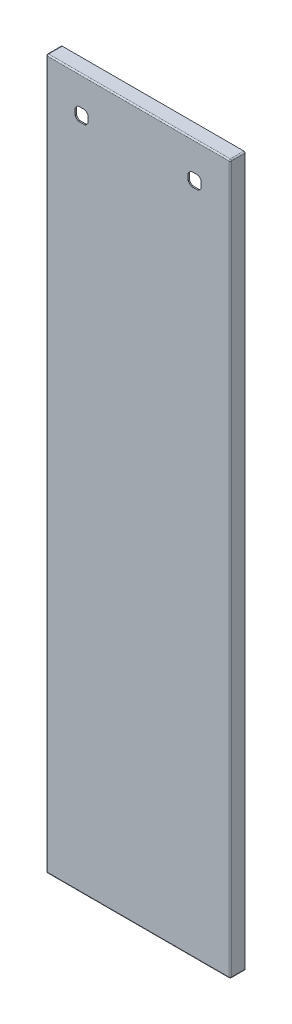
from build123d import *

# Parameters (mm, degrees)
SKIZZE1_W                       = 285
SKIZZE1_H                       = 1098
BASIS_LINEAR_AUSTRAGEN_DEPTH    = 23
WANDUNG1_T                      = -2
VERRUNDUNG1_R                   = 2
SCHNITT_LINEAR_AUSTRAGEN1_REACH = 1109.447
SCHNITT_LINEAR_AUSTRAGEN2_REACH = 1109.447


with BuildPart() as part:
    # Skizze1 → Basis-Linear austragen (new body)
    with BuildSketch(Plane.XY):
        with Locations((0, 549)):
            Rectangle(SKIZZE1_W, SKIZZE1_H)
    extrude(amount=-BASIS_LINEAR_AUSTRAGEN_DEPTH)

    # Wandung1
    wandung1_openings = [part.faces().sort_by_distance(p)[0] for p in [
        (0, 549, -23),
    ]]
    offset(amount=WANDUNG1_T, openings=wandung1_openings, kind=Kind.INTERSECTION)

    # Verrundung1
    verrundung1_edges = [part.edges().sort_by_distance(p)[0] for p in [
        (0, 1098, 0),
        (142.5, 549, 0),
        (0, 0, 0),
        (-142.5, 549, 0),
        (-142.5, 1098, -11.5),
        (142.5, 1098, -11.5),
        (142.5, 0, -11.5),
        (-142.5, 0, -11.5),
    ]]
    fillet(verrundung1_edges, radius=VERRUNDUNG1_R)

    # Skizze2 → Schnitt-Linear austragen1 (cut, up to next)
    with BuildSketch(Plane.XY, mode=Mode.PRIVATE) as schnitt_linear_austragen1_sk1:
        with BuildLine():
            Line((-92.555689864, 1053.05), (-82.444310136, 1053.05))
            ThreePointArc((-82.444310136, 1053.05), (-79.545048712, 1050.954951288), (-77.45, 1048.055689864))
            Line((-77.45, 1048.055689864), (-77.45, 1037.944310136))
            ThreePointArc((-77.45, 1037.944310136), (-79.545048712, 1035.045048712), (-82.444310136, 1032.95))
            Line((-82.444310136, 1032.95), (-92.555689864, 1032.95))
            ThreePointArc((-92.555689864, 1032.95), (-95.454951288, 1035.045048712), (-97.55, 1037.944310136))
            Line((-97.55, 1037.944310136), (-97.55, 1048.055689864))
            ThreePointArc((-97.55, 1048.055689864), (-95.454951288, 1050.954951288), (-92.555689864, 1053.05))
        make_face()
    schnitt_linear_austragen1_tool1 = extrude(schnitt_linear_austragen1_sk1.sketch, amount=-SCHNITT_LINEAR_AUSTRAGEN1_REACH, mode=Mode.PRIVATE) & part.part
    schnitt_linear_austragen1 = schnitt_linear_austragen1_tool1.solids().sort_by_distance((-87.5, 1043, 0))[0]
    add(schnitt_linear_austragen1, mode=Mode.SUBTRACT)

    # Skizze3 → Schnitt-Linear austragen2 (cut, up to next)
    with BuildSketch(Plane.XZ, mode=Mode.PRIVATE) as schnitt_linear_austragen2_sk1:
        with BuildLine():
            Line((-89.5, -7.9), (-79.7, -7.9))
            ThreePointArc((-79.7, -7.9), (-76.6, -11), (-79.7, -14.1))
            Line((-79.7, -14.1), (-89.5, -14.1))
            ThreePointArc((-89.5, -14.1), (-92.6, -11), (-89.5, -7.9))
        make_face()
    schnitt_linear_austragen2_tool1 = extrude(schnitt_linear_austragen2_sk1.sketch, amount=-SCHNITT_LINEAR_AUSTRAGEN2_REACH, mode=Mode.PRIVATE) & part.part
    schnitt_linear_austragen2 = schnitt_linear_austragen2_tool1.solids().sort_by_distance((-84.6, 0, -11))[0]
    add(schnitt_linear_austragen2, mode=Mode.SUBTRACT)

    # Spiegeln1: Schnitt-Linear austragen1, Schnitt-Linear austragen2 across plane
    add(schnitt_linear_austragen1.mirror(Plane(origin=(0, 0, 0), x_dir=(0, 0, 1), z_dir=(1, 0, 0))), mode=Mode.SUBTRACT)
    add(schnitt_linear_austragen2.mirror(Plane(origin=(0, 0, 0), x_dir=(0, 0, 1), z_dir=(1, 0, 0))), mode=Mode.SUBTRACT)


solid = part.part
